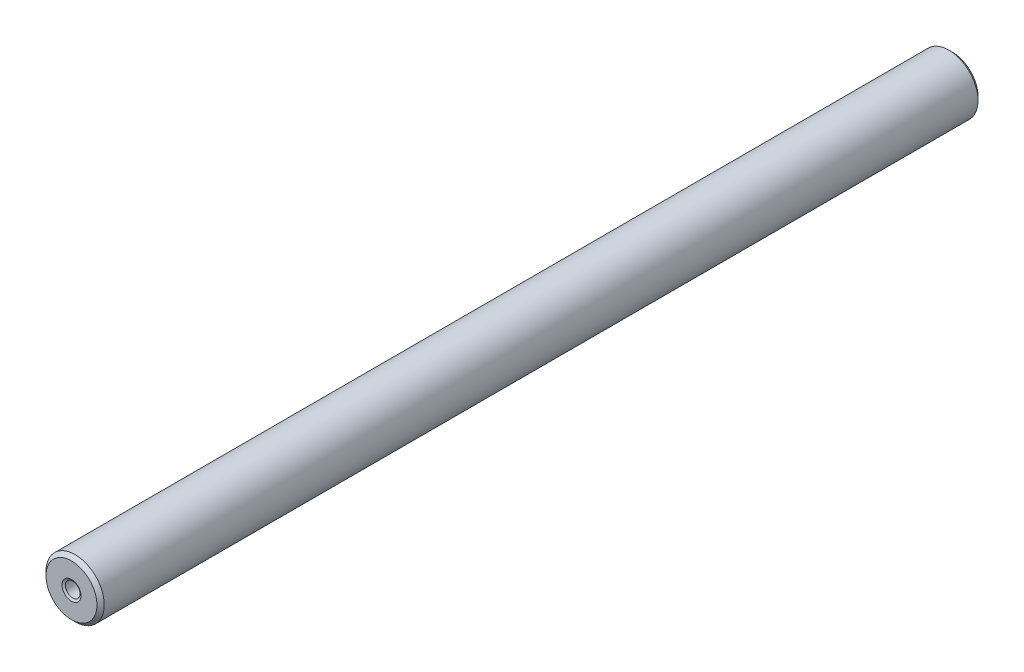
from build123d import *
from OCP.BRepFilletAPI import BRepFilletAPI_MakeChamfer

# Parameters (mm, degrees)
CHAMFER1_SIZE  = 0.5
CHAMFER2_SIZE  = 0.3
CHAMFER2_SIZE2 = 0.173205081


with BuildPart() as part:
    # Sketch1 → Revolve1 (revolve)
    with BuildSketch(Plane(origin=(0, 0, 0), x_dir=(1, 0, 0), z_dir=(0, 1, 0)), mode=Mode.PRIVATE) as revolve1_sk:
        Polygon((-1, 0), (-4, 0), (-4, -121), (-1, -121), (-1, -119), (0, -119), (0, -2), (-1, -2), align=None)
    revolve(revolve1_sk.sketch.rotate(Axis((0, 0, 119), (0, 0, -1)), 180), axis=Axis((0, 0, 119), (0, 0, -1)))

    # Chamfer1
    chamfer1_edges = [part.edges().sort_by_distance(p)[0] for p in [
        (-4, 0, 121),
        (-4, 0, 0),
    ]]
    chamfer(chamfer1_edges, length=CHAMFER1_SIZE)

    # Chamfer2: one chamfer whose edges measure the first distance from different faces: ONE call of the kernel's chamfer builder (chamfer() names one face for all edges)
    chamfer2_edges_1 = [part.edges().sort_by_distance(p)[0] for p in [
        (-1, 0, 2),
    ]]
    chamfer2_side_1 = [part.faces().sort_by_distance(p)[0] for p in [
        (0, 0, 2),
    ]]
    chamfer2_edges_2 = [part.edges().sort_by_distance(p)[0] for p in [
        (-1, 0, 119),
    ]]
    chamfer2_side_2 = [part.faces().sort_by_distance(p)[0] for p in [
        (-1, 0, 120),
    ]]
    chamfer2_edges_3 = [part.edges().sort_by_distance(p)[0] for p in [
        (-1, 0, 121),
    ]]
    chamfer2_side_3 = [part.faces().sort_by_distance(p)[0] for p in [
        (-3.401005051, 0, 121),
    ]]
    chamfer2_edges_4 = [part.edges().sort_by_distance(p)[0] for p in [
        (-1, 0, 0),
    ]]
    chamfer2_side_4 = [part.faces().sort_by_distance(p)[0] for p in [
        (-1, 0, 1),
    ]]
    chamfer2 = BRepFilletAPI_MakeChamfer(part.part.solid().wrapped)
    for e in chamfer2_edges_1:
        chamfer2.Add(CHAMFER2_SIZE, CHAMFER2_SIZE2, e.wrapped, chamfer2_side_1[0].wrapped)  # the first distance lies on this face
    for e in chamfer2_edges_2:
        chamfer2.Add(CHAMFER2_SIZE, CHAMFER2_SIZE2, e.wrapped, chamfer2_side_2[0].wrapped)  # the first distance lies on this face
    for e in chamfer2_edges_3:
        chamfer2.Add(CHAMFER2_SIZE, CHAMFER2_SIZE2, e.wrapped, chamfer2_side_3[0].wrapped)  # the first distance lies on this face
    for e in chamfer2_edges_4:
        chamfer2.Add(CHAMFER2_SIZE, CHAMFER2_SIZE2, e.wrapped, chamfer2_side_4[0].wrapped)  # the first distance lies on this face
    add(Compound.cast(chamfer2.Shape()), mode=Mode.REPLACE)


solid = part.part
